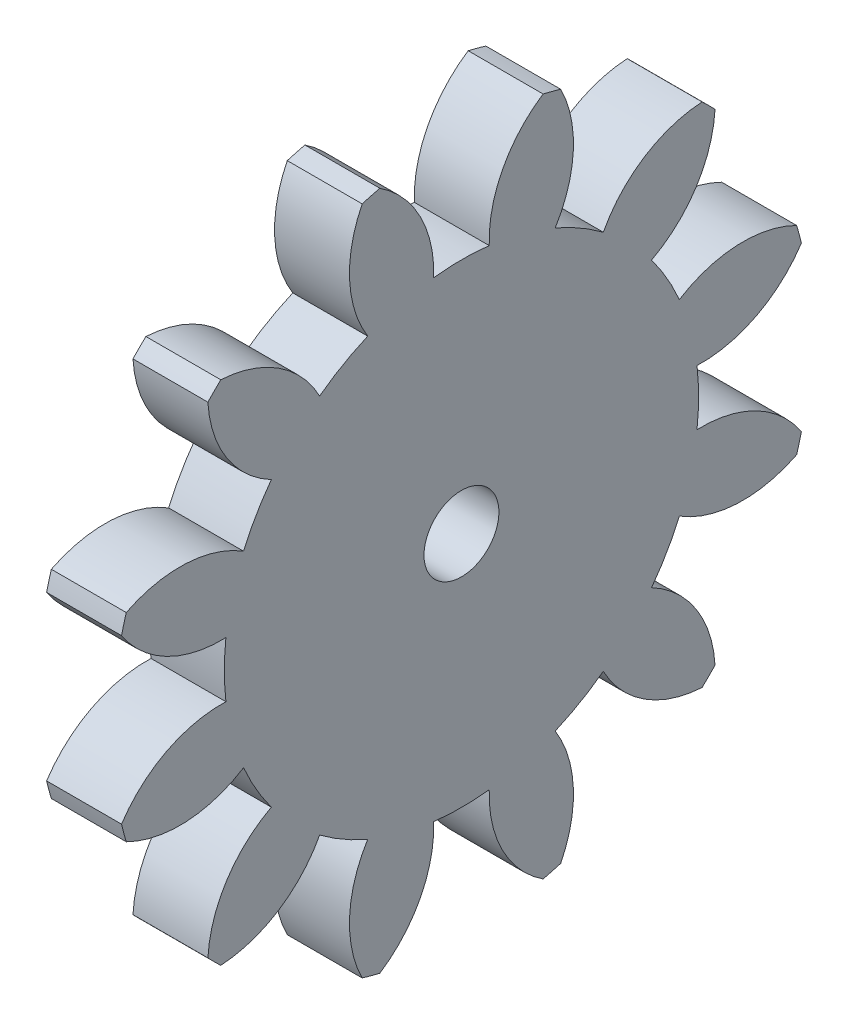
from build123d import *

# Parameters (mm, degrees)
BASPROSKE_W     = 3
BASPROSKE_H     = 14
TOOTHCUT_DEPTH  = 21.024984395
TEETHCUTS_COUNT = 12
BORSKE_R        = 1.5
BORE_DEPTH      = 50.0000508


with BuildPart() as part:
    # BasProSke → Base-Revolve (revolve)
    with BuildSketch(Plane(origin=(0, 0, 0), x_dir=(1, 0, 0), z_dir=(0, 1, 0)), mode=Mode.PRIVATE) as base_revolve_sk:
        with Locations((1.5, 7)):
            Rectangle(BASPROSKE_W, BASPROSKE_H)
    revolve(base_revolve_sk.sketch.rotate(Axis((-10, 0, 0), (1, 0, 0)), 180), axis=Axis((-10, 0, 0), (1, 0, 0)))

    # TooCutSke → ToothCut (cut, through all)
    with BuildSketch(Plane(origin=(0, 0, 0), x_dir=(0, 0, -1), z_dir=(1, 0, 0))):
        with BuildLine():
            ThreePointArc((1.111908866, 9.433698091), (0, 9.499), (-1.111908866, 9.433698091))
            ThreePointArc((-1.111908866, 9.433698091), (-1.651516138, 11.821129337), (-3.298149691, 13.632096456))
            ThreePointArc((-3.298149691, 13.632096456), (0, 14.0254), (3.298149691, 13.632096456))
            ThreePointArc((3.298149691, 13.632096456), (1.651516138, 11.821129337), (1.111908866, 9.433698091))
        make_face()
    toothcut = extrude(amount=TOOTHCUT_DEPTH, mode=Mode.SUBTRACT)

    # TeethCuts: ToothCut ×12 about axis
    teethcuts_axis = Axis((0, 0, 0), (1, 0, 0))
    for i in range(1, TEETHCUTS_COUNT):
        add(toothcut.rotate(teethcuts_axis, i * 360 / TEETHCUTS_COUNT), mode=Mode.SUBTRACT)

    # BorSke → Bore (cut, symmetric)
    with BuildSketch(Plane(origin=(0, 0, 0), x_dir=(0, 0, -1), z_dir=(1, 0, 0))):
        with Locations(Location((0, 0, 0), (0, 0, 180))):
            Circle(BORSKE_R)
    extrude(amount=BORE_DEPTH, both=True, mode=Mode.SUBTRACT)


solid = part.part
